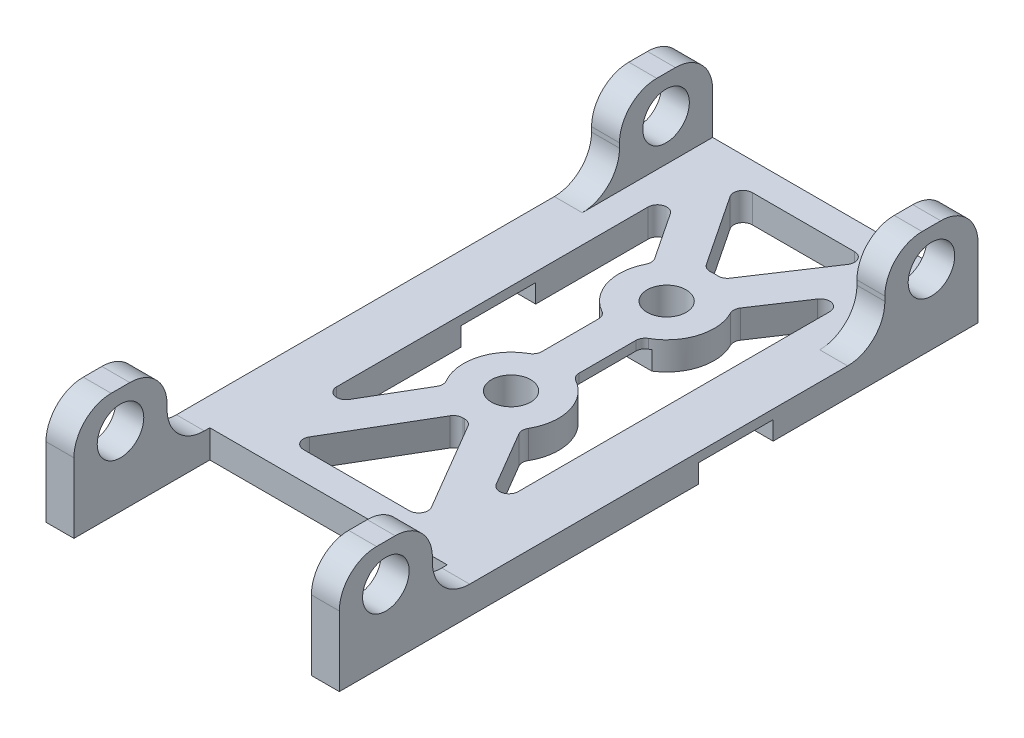
from build123d import *

# Parameters (mm, degrees)
SKETCH1_W               = 54
SKETCH1_H               = 3
BOSS_EXTRUDE1_DEPTH     = 12.75
SKETCH2_W               = 3
SKETCH2_H               = 68.59
BOSS_EXTRUDE2_DEPTH     = 3
SKETCH4_R               = 2.1
CUT_EXTRUDE2_DEPTH      = 3
SKETCH5_W               = 3
SKETCH5_H               = 10
BOSS_EXTRUDE3_DEPTH     = 8.5
SKETCH6_W               = 31.5
SKETCH6_H               = 8
CUT_EXTRUDE3_DEPTH      = 2
FILLET1_R               = 4
CUT_EXTRUDE4_DEPTH      = 52.130188209
CUT_EXTRUDE4_DEPTH_BACK = 52.130188209
CUT_EXTRUDE5_DEPTH      = 59.46780008
CUT_EXTRUDE5_DEPTH_BACK = 59.46780008
SKETCH8_R               = 2.5


with BuildPart() as part:
    # Sketch1 → Boss-Extrude1 (new, symmetric)
    with BuildSketch(Plane(origin=(0, 0, 0), x_dir=(0, 0, -1), z_dir=(1, 0, 0))):
        with Locations((20.895549337, 1.5)):
            Rectangle(SKETCH1_W, SKETCH1_H)
    extrude(amount=BOSS_EXTRUDE1_DEPTH, both=True)

    # Sketch2 → Boss-Extrude2 (add)
    with BuildSketch(Plane(origin=(0, 0, 0), x_dir=(1, 0, 0), z_dir=(0, 1, 0))):
        with Locations((14.25, 13.600549337)):
            Rectangle(SKETCH2_W, SKETCH2_H)
        with Locations((-14.25, 13.600549337)):
            Rectangle(SKETCH2_W, SKETCH2_H)
    extrude(amount=BOSS_EXTRUDE2_DEPTH)

    # Sketch4 → Cut-Extrude2 (cut)
    with BuildSketch(Plane(origin=(0, 3, 0), x_dir=(1, 0, 0), z_dir=(0, 1, 0))):
        with Locations(Location((0, 13.5, 0), (0, 0, 270))):
            Circle(SKETCH4_R)
        with BuildLine():
            ThreePointArc((0.510375011, 28.172498171), (1.842935069, 29.202762349), (1.989848247, 30.880730496))
            ThreePointArc((1.989848247, 30.880730496), (0.567559264, 32.231384351), (-1.34985398, 31.818227914))
            ThreePointArc((-1.34985398, 31.818227914), (-1.870566111, 29.255080591), (0.510375011, 28.172498171))
        make_face()
    extrude(amount=-CUT_EXTRUDE2_DEPTH, mode=Mode.SUBTRACT)

    # Sketch5 → Boss-Extrude3 (add)
    with BuildSketch(Plane(origin=(0, 3, 0), x_dir=(1, 0, 0), z_dir=(0, 1, 0))):
        with Locations((-14.25, -15.694450663)):
            Rectangle(SKETCH5_W, SKETCH5_H)
        with Locations((14.25, -15.694450663)):
            Rectangle(SKETCH5_W, SKETCH5_H)
        with Locations((14.25, 42.895549337)):
            Rectangle(SKETCH5_W, SKETCH5_H)
        with Locations((-14.25, 42.895549337)):
            Rectangle(SKETCH5_W, SKETCH5_H)
    extrude(amount=BOSS_EXTRUDE3_DEPTH)

    # Sketch6 → Cut-Extrude3 (cut)
    with BuildSketch(Plane.XZ):
        with Locations((0, -21.895549337)):
            Rectangle(SKETCH6_W, SKETCH6_H)
    extrude(amount=-CUT_EXTRUDE3_DEPTH, mode=Mode.SUBTRACT)

    # Fillet1
    fillet1_edges = [part.edges().sort_by_distance(p)[0] for p in [
        (-14.25, 3, -37.895549337),
        (-14.25, 11.5, -47.895549337),
        (-14.25, 11.5, -37.895549337),
        (14.25, 3, -37.895549337),
        (14.25, 11.5, -37.895549337),
        (14.25, 11.5, -47.895549337),
        (14.25, 3, 10.694450663),
        (14.25, 11.5, 20.694450663),
        (14.25, 11.5, 10.694450663),
        (-14.25, 3, 10.694450663),
        (-14.25, 11.5, 10.694450663),
        (-14.25, 11.5, 20.694450663),
    ]]
    fillet(fillet1_edges, radius=FILLET1_R)

    # Sketch7 → Cut-Extrude4 (cut, two sides: drawn at the far end of the back side and taken through both)
    with BuildSketch(Plane(origin=(0, 3, 0), x_dir=(1, 0, 0), z_dir=(0, 1, 0)).offset(-CUT_EXTRUDE4_DEPTH_BACK)):
        with BuildLine():
            Line((0.964735196, 7.90721125), (6.54617705, -1.598099098))
            ThreePointArc((6.54617705, -1.598099098), (6.551706918, -2.60126473), (5.683849912, -3.104450663))
            Line((5.683849912, -3.104450663), (-5.683849912, -3.104450663))
            ThreePointArc((-5.683849912, -3.104450663), (-6.551706918, -2.60126473), (-6.54617705, -1.598099098))
            Line((-6.54617705, -1.598099098), (-0.964735196, 7.90721125))
            ThreePointArc((-0.964735196, 7.90721125), (-0.591919483, 8.272856568), (-0.085619852, 8.400718753))
            ThreePointArc((-0.085619852, 8.400718753), (0, 8.4), (0.085619852, 8.400718753))
            ThreePointArc((0.085619852, 8.400718753), (0.591919483, 8.272856568), (0.964735196, 7.90721125))
        make_face()
        with BuildLine():
            Line((-4.603921215, 33.528255639), (-7.916886234, 38.518435448))
            ThreePointArc((-7.916886234, 38.518435448), (-9.038865223, 38.922703555), (-9.75, 37.965333782))
            Line((-9.75, 37.965333782), (-9.75, 4.523307202))
            ThreePointArc((-9.75, 4.523307202), (-9.012366978, 3.558339032), (-7.887672863, 4.016955636))
            Line((-7.887672863, 4.016955636), (-4.414043746, 9.932617513))
            ThreePointArc((-4.414043746, 9.932617513), (-4.276374342, 10.436338854), (-4.41139205, 10.940777426))
            ThreePointArc((-4.41139205, 10.940777426), (-4.921337666, 14.838071589), (-2.508196721, 17.940602347))
            ThreePointArc((-2.508196721, 17.940602347), (-2.136344027, 18.30722699), (-2, 18.81130869))
            Line((-2, 18.81130869), (-2, 24.898225894))
            ThreePointArc((-2, 24.898225894), (-2.136344027, 25.402307594), (-2.508196721, 25.768932236))
            ThreePointArc((-2.508196721, 25.768932236), (-4.882585845, 28.736321948), (-4.545717772, 32.521773745))
            ThreePointArc((-4.545717772, 32.521773745), (-4.438702873, 33.032886126), (-4.603921215, 33.528255639))
        make_face()
        with BuildLine():
            Line((1.27146615, 35.740662301), (6.318268064, 43.342447671))
            ThreePointArc((6.318268064, 43.342447671), (6.366375514, 44.368253438), (5.485154298, 44.895549337))
            Line((5.485154298, 44.895549337), (-5.485154298, 44.895549337))
            ThreePointArc((-5.485154298, 44.895549337), (-6.366375514, 44.368253438), (-6.318268064, 43.342447671))
            Line((-6.318268064, 43.342447671), (-1.27146615, 35.740662301))
            ThreePointArc((-1.27146615, 35.740662301), (-0.879067636, 35.396117006), (-0.366491338, 35.296349314))
            ThreePointArc((-0.366491338, 35.296349314), (0, 35.309534584), (0.366491338, 35.296349314))
            ThreePointArc((0.366491338, 35.296349314), (0.879067636, 35.396117006), (1.27146615, 35.740662301))
        make_face()
        with BuildLine():
            Line((4.603921215, 33.528255639), (7.916886234, 38.518435448))
            ThreePointArc((7.916886234, 38.518435448), (9.038865223, 38.922703555), (9.75, 37.965333782))
            Line((9.75, 37.965333782), (9.75, 4.523307202))
            ThreePointArc((9.75, 4.523307202), (9.012366978, 3.558339032), (7.887672863, 4.016955636))
            Line((7.887672863, 4.016955636), (4.414043746, 9.932617513))
            ThreePointArc((4.414043746, 9.932617513), (4.276374342, 10.436338854), (4.41139205, 10.940777426))
            ThreePointArc((4.41139205, 10.940777426), (4.921337666, 14.838071589), (2.508196721, 17.940602347))
            ThreePointArc((2.508196721, 17.940602347), (2.136344027, 18.30722699), (2, 18.81130869))
            Line((2, 18.81130869), (2, 24.898225894))
            ThreePointArc((2, 24.898225894), (2.136344027, 25.402307594), (2.508196721, 25.768932236))
            ThreePointArc((2.508196721, 25.768932236), (4.882585845, 28.736321948), (4.545717772, 32.521773745))
            ThreePointArc((4.545717772, 32.521773745), (4.438702873, 33.032886126), (4.603921215, 33.528255639))
        make_face()
    extrude(amount=CUT_EXTRUDE4_DEPTH + CUT_EXTRUDE4_DEPTH_BACK, mode=Mode.SUBTRACT)

    # Sketch8 → Cut-Extrude5 (cut, two sides: drawn at the far end of the back side and taken through both)
    with BuildSketch(Plane(origin=(15.75, 0, 0), x_dir=(0, 0, -1), z_dir=(1, 0, 0)).offset(-CUT_EXTRUDE5_DEPTH_BACK)):
        with Locations((-15.694450663, 7.5)):
            Circle(SKETCH8_R)
        with Locations(Location((42.895549337, 7.5, 0), (0, 0, 180))):
            Circle(SKETCH8_R)
    extrude(amount=CUT_EXTRUDE5_DEPTH + CUT_EXTRUDE5_DEPTH_BACK, mode=Mode.SUBTRACT)


solid = part.part
